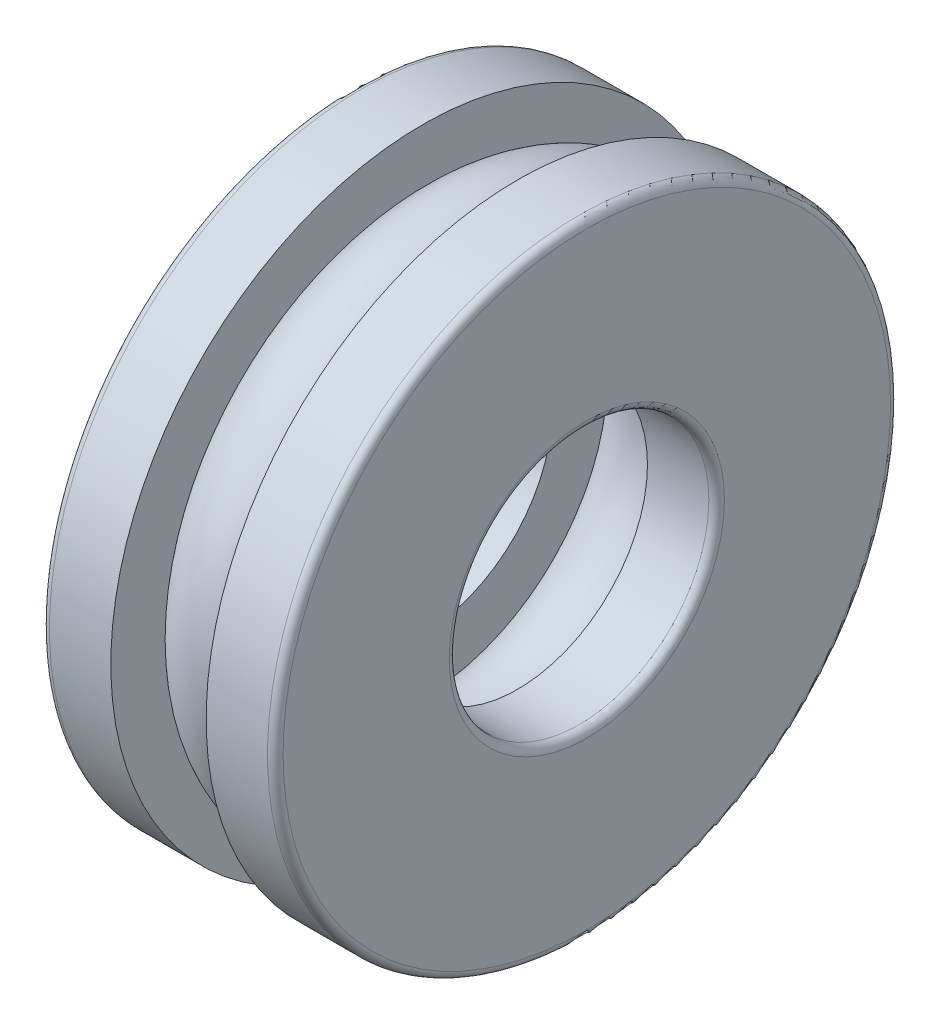
from build123d import *

# Parameters (mm, degrees)
BALSIMSKE_R = 2.295


with BuildPart() as part:
    # InnRacSke → Race (revolve)
    with BuildSketch(Plane.XY, mode=Mode.PRIVATE) as race_sk:
        with BuildLine():
            Line((-1.836, 7.165082774), (-1.836, 5))
            Line((-1.836, 5), (-4.2, 5))
            ThreePointArc((-4.2, 5), (-4.412132034, 5.087867966), (-4.5, 5.3))
            Line((-4.5, 5.3), (-4.5, 11.7))
            ThreePointArc((-4.5, 11.7), (-4.412132034, 11.912132034), (-4.2, 12))
            Line((-4.2, 12), (-1.836, 12))
            Line((-1.836, 12), (-1.836, 9.834917226))
            ThreePointArc((-1.836, 9.834917226), (-2.27, 8.5), (-1.836, 7.165082774))
        make_face()
    race = revolve(race_sk.sketch.rotate(Axis((-34.925, 0, 0), (1, 0, 0)), 270), axis=Axis((-34.925, 0, 0), (1, 0, 0)))

    # BalSimSke → BallsSimplified (revolve)
    with BuildSketch(Plane.XY, mode=Mode.PRIVATE) as ballssimplified_sk:
        with Locations((0, 8.5)):
            Circle(BALSIMSKE_R)
    revolve(ballssimplified_sk.sketch.rotate(Axis((-25.4, 0, 0), (1, 0, 0)), 90), axis=Axis((-25.4, 0, 0), (1, 0, 0)))

    # Mirror1: Race across plane
    add(race.mirror(Plane(origin=(0, 0, 0), x_dir=(0, 0, 1), z_dir=(1, 0, 0))))


solid = part.part
